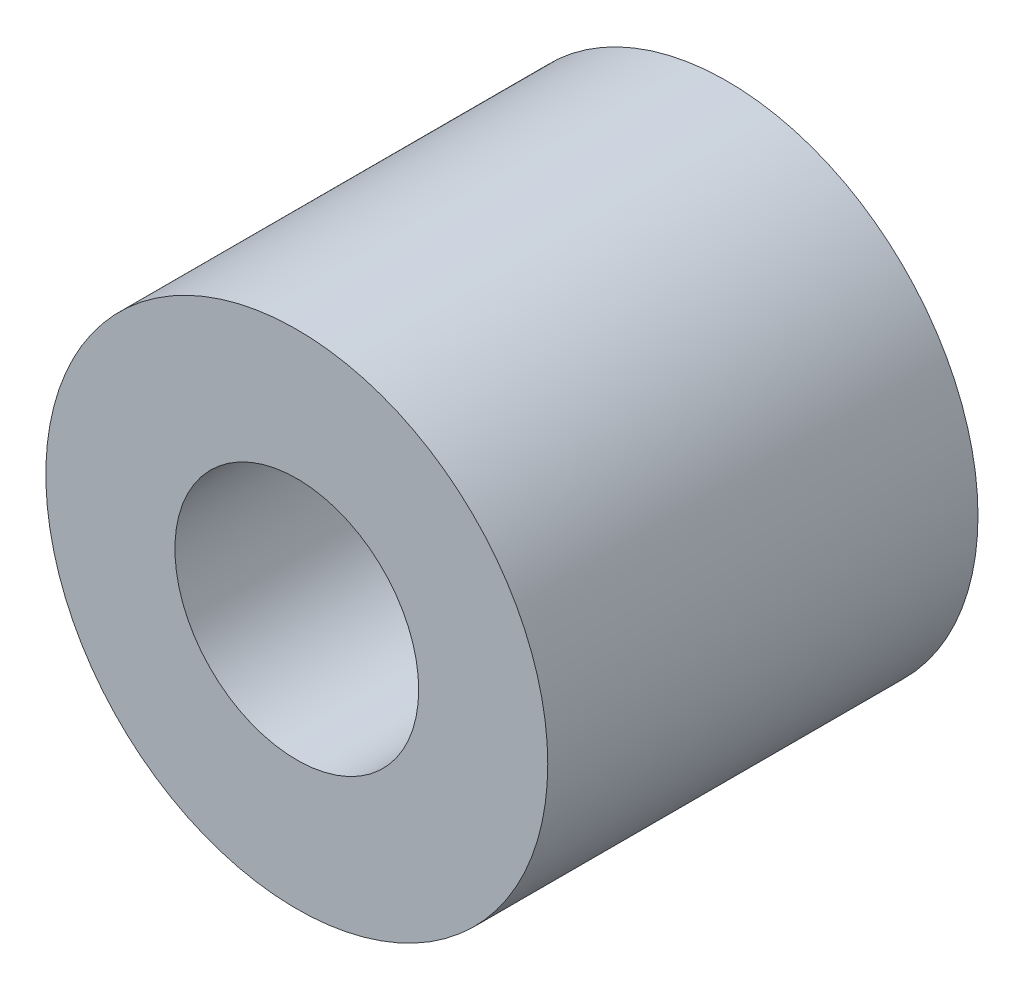
from build123d import *

# Parameters (mm, degrees)
SKETCH1_R           = 3.5
SKETCH1_R_2         = 1.7
BOSS_EXTRUDE1_DEPTH = 6


with BuildPart() as part:
    # Sketch1 → Boss-Extrude1 (new body)
    with BuildSketch(Plane.XY):
        Circle(SKETCH1_R)
        Circle(SKETCH1_R_2, mode=Mode.SUBTRACT)
    extrude(amount=BOSS_EXTRUDE1_DEPTH)


solid = part.part
